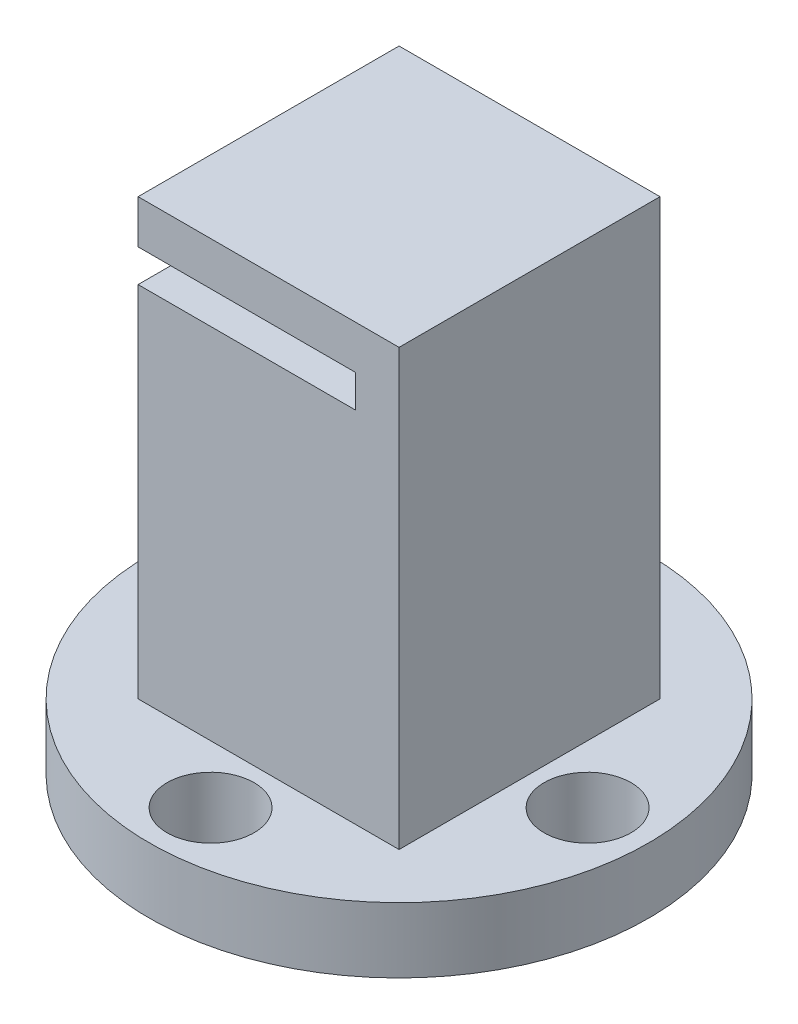
from build123d import *

# Parameters (mm, degrees)
CROQUIS1_W              = 12
CROQUIS1_H              = 12
SALIENTE_EXTRUIR1_DEPTH = 20
CROQUIS2_W              = 10
CROQUIS2_H              = 1.5
CORTAR_EXTRUIR1_DEPTH   = 10
CROQUIS3_R              = 11.478178836
CROQUIS3_R_2            = 2
SALIENTE_EXTRUIR2_DEPTH = 3


with BuildPart() as part:
    # Croquis1 → Saliente-Extruir1 (new body)
    with BuildSketch(Plane(origin=(0, 0, 0), x_dir=(1, 0, 0), z_dir=(0, 1, 0))):
        with Locations((6, 6)):
            Rectangle(CROQUIS1_W, CROQUIS1_H)
    extrude(amount=SALIENTE_EXTRUIR1_DEPTH)

    # Croquis2 → Cortar-Extruir1 (cut)
    with BuildSketch(Plane.XY):
        with Locations((5, 17.25)):
            Rectangle(CROQUIS2_W, CROQUIS2_H)
    extrude(amount=-CORTAR_EXTRUIR1_DEPTH, mode=Mode.SUBTRACT)

    # Croquis3 → Saliente-Extruir2 (add)
    with BuildSketch(Plane.XZ):
        with Locations(Location((6, -6, 0), (0, 0, 270))):
            Circle(CROQUIS3_R)
        with Locations(Location((14.668474488, -6, 0), (0, 0, 270))):
            Circle(CROQUIS3_R_2, mode=Mode.SUBTRACT)
        with Locations(Location((6, -14.668474488, 0), (0, 0, 270))):
            Circle(CROQUIS3_R_2, mode=Mode.SUBTRACT)
        with Locations(Location((-2.668474488, -6, 0), (0, 0, 270))):
            Circle(CROQUIS3_R_2, mode=Mode.SUBTRACT)
        with Locations(Location((6, 2.668474488, 0), (0, 0, 270))):
            Circle(CROQUIS3_R_2, mode=Mode.SUBTRACT)
    extrude(amount=SALIENTE_EXTRUIR2_DEPTH)


solid = part.part
